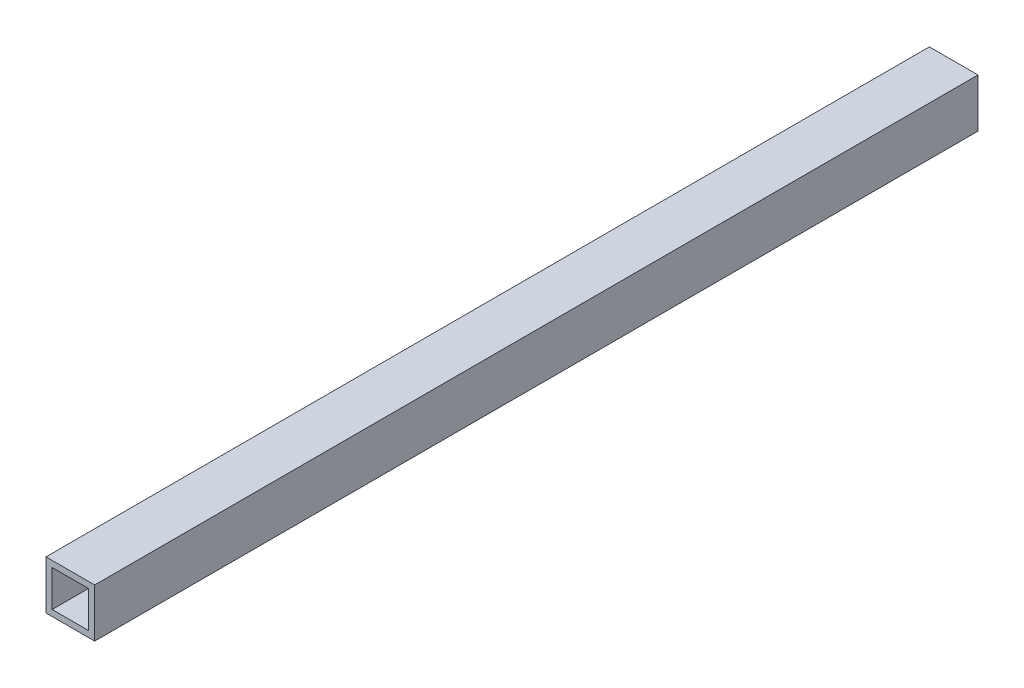
from build123d import *

# Parameters (mm, degrees)
SKETCH1_W           = 12.12
SKETCH1_H           = 12.12
SKETCH1_W_2         = 9.06
SKETCH1_H_2         = 9.06
BOSS_EXTRUDE1_DEPTH = 110


with BuildPart() as part:
    # Sketch1 → Boss-Extrude1 (new, symmetric)
    with BuildSketch(Plane.XY):
        Rectangle(SKETCH1_W, SKETCH1_H)
        Rectangle(SKETCH1_W_2, SKETCH1_H_2, mode=Mode.SUBTRACT)
    extrude(amount=BOSS_EXTRUDE1_DEPTH, both=True)


solid = part.part
